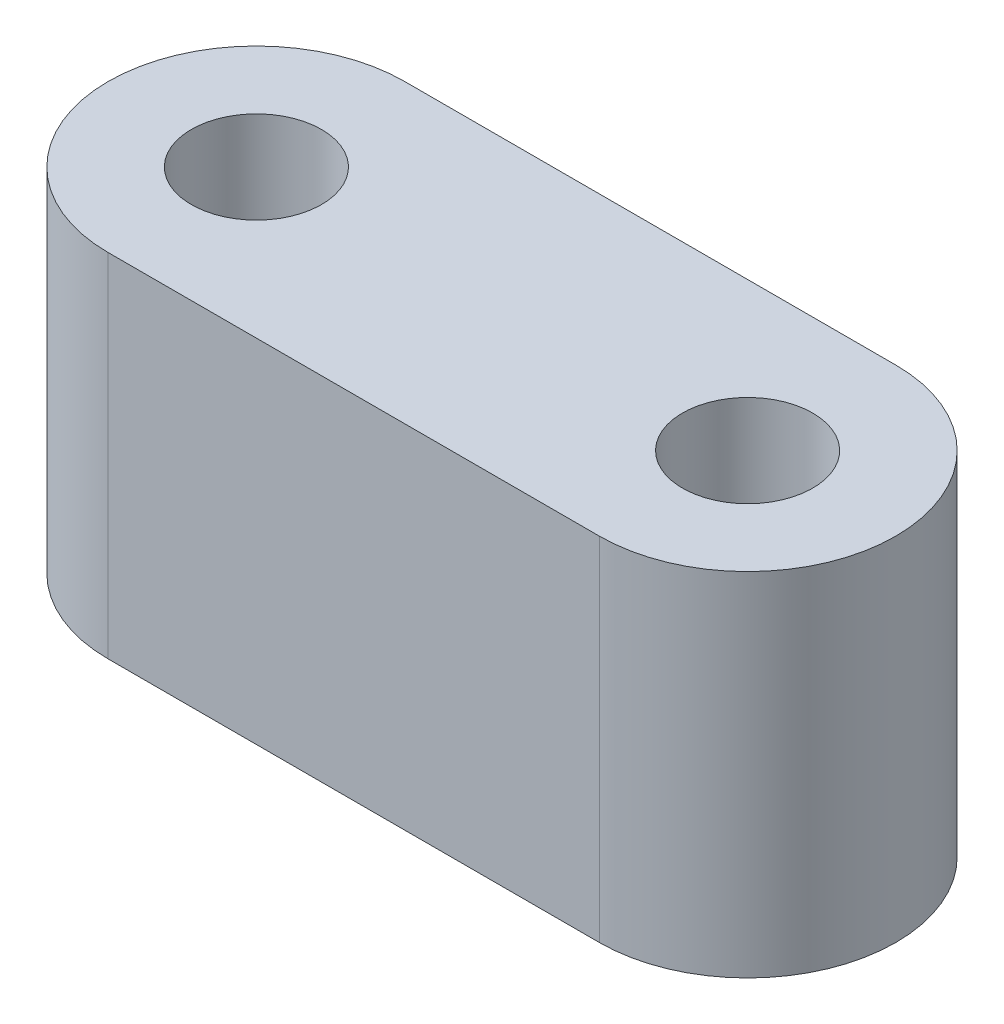
from build123d import *

# Parameters (mm, degrees)
BOSS_EXTRUDE1_DEPTH     = 19.304
F_1_4_CLEARANCE_HOLE1_D = 7.14248


with BuildPart() as part:
    # Sketch1 → Boss-Extrude1 (new body)
    with BuildSketch(Plane(origin=(0, 0, 0), x_dir=(1, 0, 0), z_dir=(0, 1, 0))):
        with BuildLine():
            Line((-26.940764, 8.128), (0, 8.128))
            ThreePointArc((0, 8.128), (8.128, 0), (0, -8.128))
            Line((0, -8.128), (-26.940764, -8.128))
            ThreePointArc((-26.940764, -8.128), (-35.068764, 0), (-26.940764, 8.128))
        make_face()
    extrude(amount=BOSS_EXTRUDE1_DEPTH)

    # 1/4 Clearance Hole1 (through all)
    with Locations(Plane(origin=(0, 0, 0), x_dir=(-1, 0, 0), z_dir=(0, -1, 0))):
        with Locations((0, 0), (26.940764, 0)):
            Hole(F_1_4_CLEARANCE_HOLE1_D / 2)


solid = part.part
